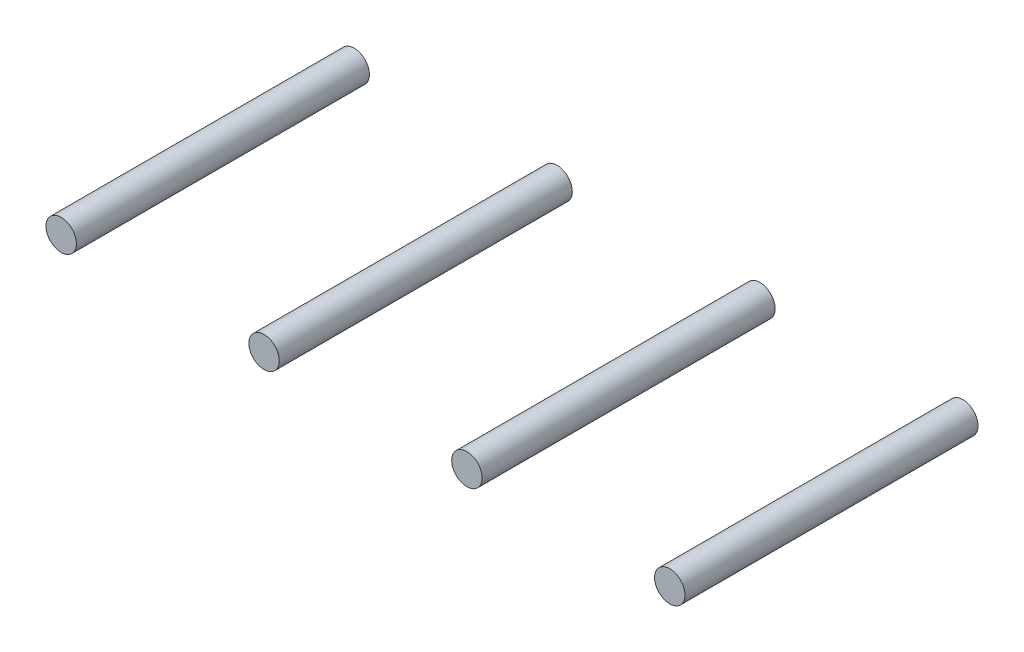
from build123d import *

# Parameters (mm, degrees)
BOSS_EXTRUDE1_DEPTH        = 10
BOSS_EXTRUDE1_DEPTH_BACK   = 16
SKETCH1_R                  = 1.35
BOSS_EXTRUDE1_2_DEPTH      = 10
BOSS_EXTRUDE1_2_DEPTH_BACK = 16
BOSS_EXTRUDE1_3_DEPTH      = 10
BOSS_EXTRUDE1_3_DEPTH_BACK = 16
BOSS_EXTRUDE1_4_DEPTH      = 10
BOSS_EXTRUDE1_4_DEPTH_BACK = 16


with BuildPart() as part:
    # Sketch1 → Boss-Extrude1 (new, two sides: drawn at the far end of the back side and taken through both)
    with BuildSketch(Plane.XY.offset(-BOSS_EXTRUDE1_DEPTH_BACK)):
        with Locations((-27, -35)):
            Circle(SKETCH1_R)
    extrude(amount=BOSS_EXTRUDE1_DEPTH + BOSS_EXTRUDE1_DEPTH_BACK)


with BuildPart() as body_2:
    # Sketch1 → Boss-Extrude1 2 (new, two sides: drawn at the far end of the back side and taken through both)
    with BuildSketch(Plane.XY.offset(-BOSS_EXTRUDE1_2_DEPTH_BACK)):
        with Locations((-9, -35)):
            Circle(SKETCH1_R)
    extrude(amount=BOSS_EXTRUDE1_2_DEPTH + BOSS_EXTRUDE1_2_DEPTH_BACK)


with BuildPart() as body_3:
    # Sketch1 → Boss-Extrude1 3 (new, two sides: drawn at the far end of the back side and taken through both)
    with BuildSketch(Plane.XY.offset(-BOSS_EXTRUDE1_3_DEPTH_BACK)):
        with Locations(Location((27, -35, 0), (0, 0, 90))):
            Circle(SKETCH1_R)
    extrude(amount=BOSS_EXTRUDE1_3_DEPTH + BOSS_EXTRUDE1_3_DEPTH_BACK)


with BuildPart() as body_4:
    # Sketch1 → Boss-Extrude1 4 (new, two sides: drawn at the far end of the back side and taken through both)
    with BuildSketch(Plane.XY.offset(-BOSS_EXTRUDE1_4_DEPTH_BACK)):
        with Locations(Location((9, -35, 0), (0, 0, 90))):
            Circle(SKETCH1_R)
    extrude(amount=BOSS_EXTRUDE1_4_DEPTH + BOSS_EXTRUDE1_4_DEPTH_BACK)


solid = Compound([part.part, body_2.part, body_3.part, body_4.part])
